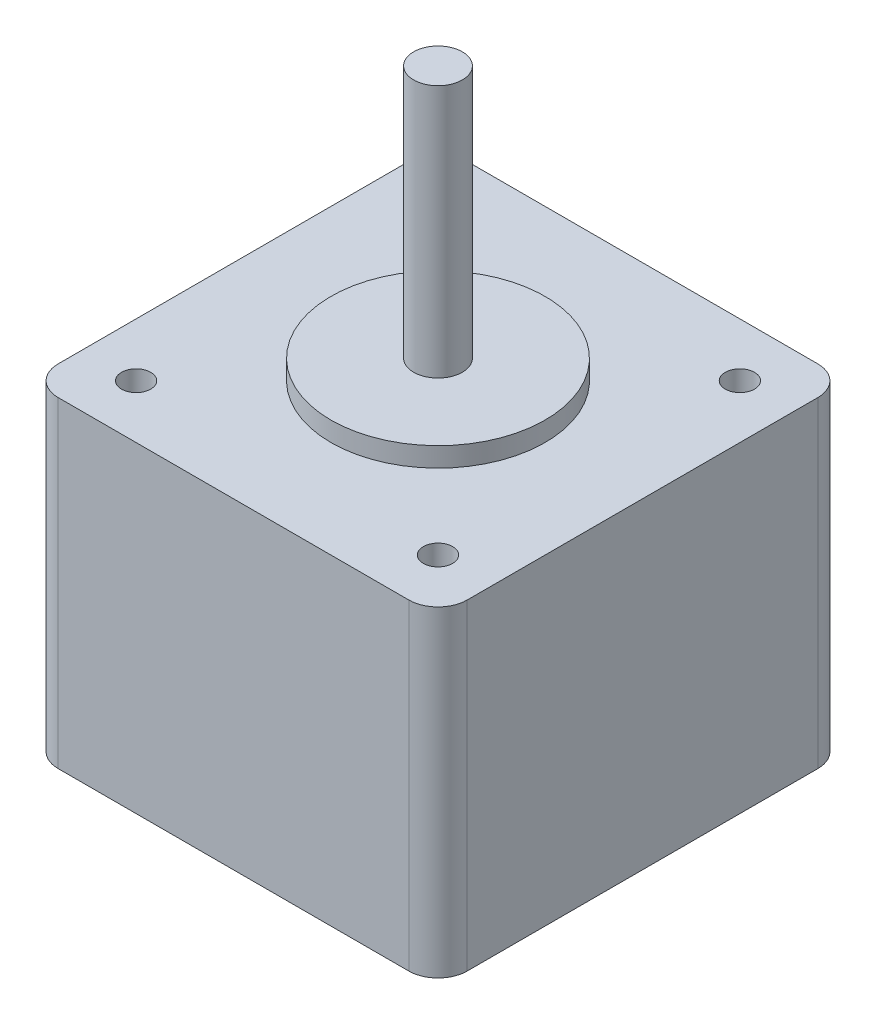
from build123d import *

# Parameters (mm, degrees)
SKETCH1_W           = 42
SKETCH1_H           = 42
BOSS_EXTRUDE1_DEPTH = 33
SKETCH2_R           = 2.5
BOSS_EXTRUDE2_DEPTH = 28
FILLET1_R           = 3
SKETCH3_R           = 1.5
CUT_EXTRUDE1_DEPTH  = 4.5
SKETCH4_R           = 11
BOSS_EXTRUDE3_DEPTH = 2


with BuildPart() as part:
    # Sketch1 → Boss-Extrude1 (new body)
    with BuildSketch(Plane(origin=(0, 0, 0), x_dir=(1, 0, 0), z_dir=(0, 1, 0))):
        with Locations((21, 21)):
            Rectangle(SKETCH1_W, SKETCH1_H)
    extrude(amount=BOSS_EXTRUDE1_DEPTH)

    # Sketch2 → Boss-Extrude2 (add)
    with BuildSketch(Plane(origin=(0, 33, 0), x_dir=(1, 0, 0), z_dir=(0, 1, 0))):
        with Locations(Location((21, 21, 0), (0, 0, 90))):
            Circle(SKETCH2_R)
    extrude(amount=BOSS_EXTRUDE2_DEPTH)

    # Fillet1
    fillet1_edges = [part.edges().sort_by_distance(p)[0] for p in [
        (42, 16.5, -42),
        (42, 16.5, 0),
        (0, 16.5, 0),
        (0, 16.5, -42),
    ]]
    fillet(fillet1_edges, radius=FILLET1_R)

    # Sketch3 → Cut-Extrude1 (cut)
    with BuildSketch(Plane(origin=(0, 33, 0), x_dir=(1, 0, 0), z_dir=(0, 1, 0))):
        with Locations(Location((5.5, 36.5, 0), (0, 0, 270))):
            Circle(SKETCH3_R)
        with Locations(Location((5.5, 5.5, 0), (0, 0, 90))):
            Circle(SKETCH3_R)
        with Locations(Location((36.5, 5.5, 0), (0, 0, 270))):
            Circle(SKETCH3_R)
        with Locations(Location((36.5, 36.5, 0), (0, 0, 90))):
            Circle(SKETCH3_R)
    extrude(amount=-CUT_EXTRUDE1_DEPTH, mode=Mode.SUBTRACT)

    # Sketch4 → Boss-Extrude3 (add)
    with BuildSketch(Plane(origin=(0, 33, 0), x_dir=(1, 0, 0), z_dir=(0, 1, 0))):
        with Locations(Location((21, 21, 0), (0, 0, 270))):
            Circle(SKETCH4_R)
    extrude(amount=BOSS_EXTRUDE3_DEPTH)


solid = part.part
